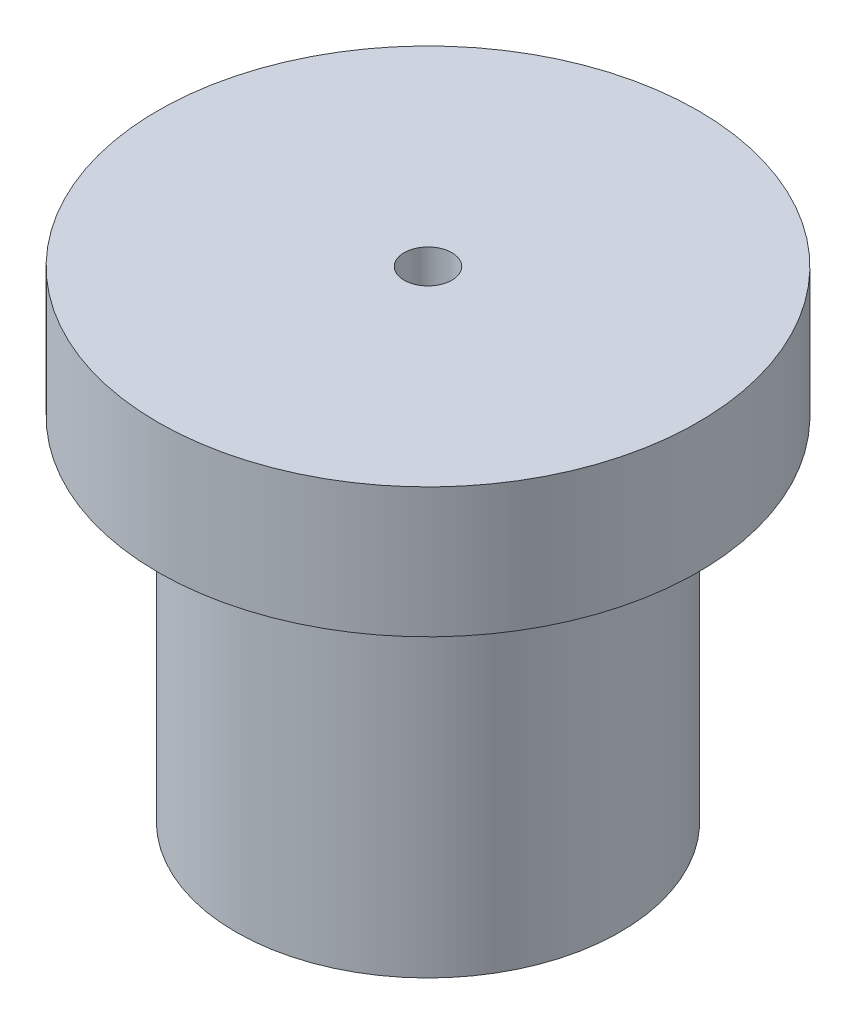
from build123d import *

# Parameters (mm, degrees)
SKETCH1_R           = 9.398
SKETCH1_R_2         = 1.1684
BOSS_EXTRUDE1_DEPTH = 17.145
SKETCH2_R           = 13.208
SKETCH2_R_2         = 1.1684
BOSS_EXTRUDE2_DEPTH = 6.35


with BuildPart() as part:
    # Sketch1 → Boss-Extrude1 (new body)
    with BuildSketch(Plane(origin=(0, 0, 0), x_dir=(1, 0, 0), z_dir=(0, 1, 0))):
        with Locations(Location((0, 0, 0), (0, 0, 270))):
            Circle(SKETCH1_R)
        with Locations(Location((0, 0, 0), (0, 0, 270))):
            Circle(SKETCH1_R_2, mode=Mode.SUBTRACT)
    extrude(amount=BOSS_EXTRUDE1_DEPTH)

    # Sketch2 → Boss-Extrude2 (add)
    with BuildSketch(Plane(origin=(0, 17.145, 0), x_dir=(1, 0, 0), z_dir=(0, 1, 0))):
        with Locations(Location((0, 0, 0), (0, 0, 270))):
            Circle(SKETCH2_R)
        with Locations(Location((0, 0, 0), (0, 0, 270))):
            Circle(SKETCH2_R_2, mode=Mode.SUBTRACT)
    extrude(amount=BOSS_EXTRUDE2_DEPTH)


solid = part.part
